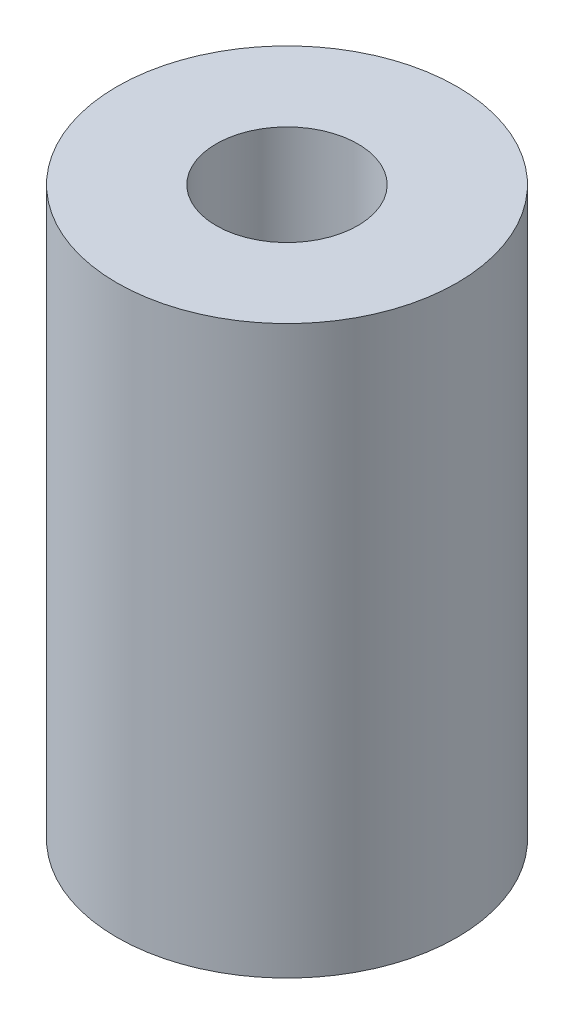
from build123d import *

# Parameters (mm, degrees)
SKETCH1_R           = 6
BOSS_EXTRUDE1_DEPTH = 20
SKETCH2_R           = 2.5
CUT_EXTRUDE1_DEPTH  = 10
CUT_EXTRUDE2_START  = -10
SKETCH3_R           = 2.5
CUT_EXTRUDE2_DEPTH  = 10


with BuildPart() as part:
    # Sketch1 → Boss-Extrude1 (new body)
    with BuildSketch(Plane(origin=(0, 0, 0), x_dir=(1, 0, 0), z_dir=(0, 1, 0))):
        with Locations(Location((0, 0, 0), (0, 0, 270))):
            Circle(SKETCH1_R)
    extrude(amount=BOSS_EXTRUDE1_DEPTH)

    # Sketch2 → Cut-Extrude1 (cut)
    with BuildSketch(Plane(origin=(0, 20, 0), x_dir=(1, 0, 0), z_dir=(0, 1, 0))):
        with Locations(Location((0, 0, 0), (0, 0, 270))):
            Circle(SKETCH2_R)
    extrude(amount=-CUT_EXTRUDE1_DEPTH, mode=Mode.SUBTRACT)

    # Sketch3 → Cut-Extrude2 (cut)
    with BuildSketch(Plane(origin=(0, 0, 0), x_dir=(-1, 0, 0), z_dir=(0, -1, 0)).offset(CUT_EXTRUDE2_START)):
        with Locations(Location((0, 0, 0), (0, 0, 270))):
            Circle(SKETCH3_R)
    extrude(amount=CUT_EXTRUDE2_DEPTH, mode=Mode.SUBTRACT)


solid = part.part
